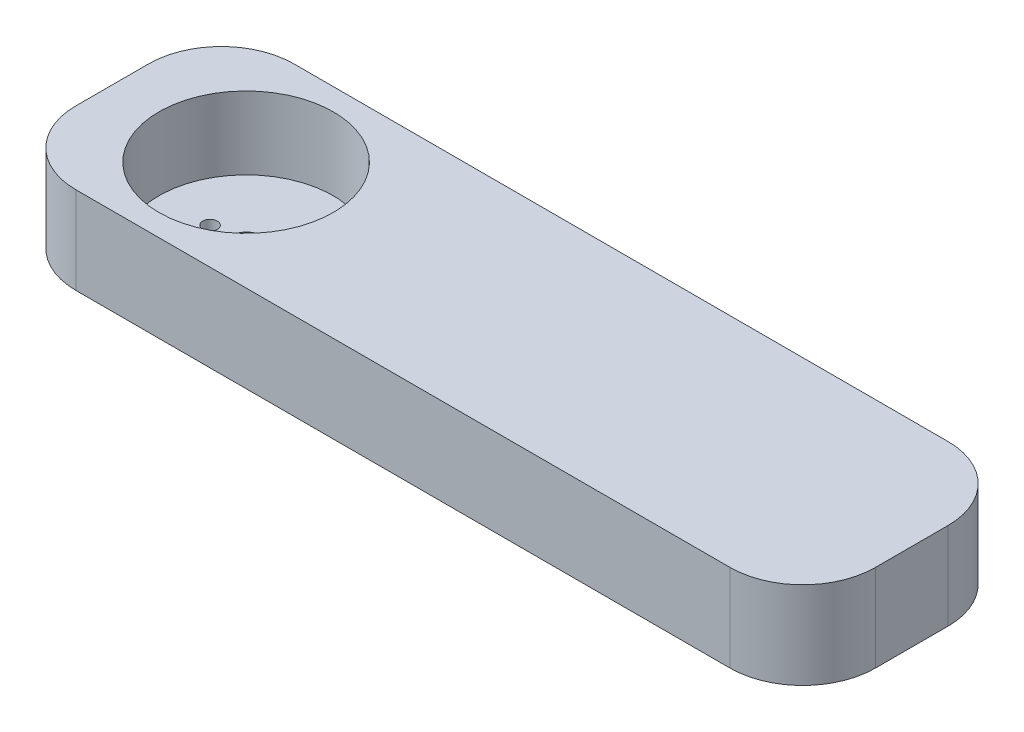
from build123d import *

# Parameters (mm, degrees)
SKETCH1_W           = 110
SKETCH1_H           = 30
BOSS_EXTRUDE1_DEPTH = 12
FILLET1_R           = 10
FILLET2_R           = 10
SKETCH9_R           = 12
CUT_EXTRUDE5_DEPTH  = 10
SKETCH10_R          = 2.4
SKETCH10_R_2        = 1
CUT_EXTRUDE6_DEPTH  = 64.95366743


with BuildPart() as part:
    # Sketch1 → Boss-Extrude1 (new body)
    with BuildSketch(Plane(origin=(0, 0, 0), x_dir=(1, 0, 0), z_dir=(0, 1, 0))):
        with Locations((5.385430756, 3.53837453)):
            Rectangle(SKETCH1_W, SKETCH1_H)
    extrude(amount=BOSS_EXTRUDE1_DEPTH)

    # Fillet1
    fillet1_edges = [part.edges().sort_by_distance(p)[0] for p in [
        (-49.614569244, 6, -18.53837453),
        (-49.614569244, 6, 11.46162547),
    ]]
    fillet(fillet1_edges, radius=FILLET1_R)

    # Fillet2
    fillet2_edges = [part.edges().sort_by_distance(p)[0] for p in [
        (60.385430756, 6, -18.53837453),
        (60.385430756, 6, 11.46162547),
    ]]
    fillet(fillet2_edges, radius=FILLET2_R)

    # Sketch9 → Cut-Extrude5 (cut)
    with BuildSketch(Plane(origin=(0, 12, 0), x_dir=(1, 0, 0), z_dir=(0, 1, 0))):
        with Locations(Location((-31.195762423, 3.53837453, 0), (0, 0, 270))):
            Circle(SKETCH9_R)
    extrude(amount=-CUT_EXTRUDE5_DEPTH, mode=Mode.SUBTRACT)

    # Sketch10 → Cut-Extrude6 (cut, through all)
    with BuildSketch(Plane(origin=(0, 2, 0), x_dir=(1, 0, 0), z_dir=(0, 1, 0))):
        with Locations(Location((-31.147671482, 3.53837453, 0), (0, 0, 270))):
            Circle(SKETCH10_R)
        with Locations(Location((-26.131792826, 3.53837453, 0), (0, 0, 270))):
            Circle(SKETCH10_R_2)
        with Locations(Location((-36.163550137, 3.53837453, 0), (0, 0, 90))):
            Circle(SKETCH10_R_2)
    extrude(amount=-CUT_EXTRUDE6_DEPTH, mode=Mode.SUBTRACT)


solid = part.part
